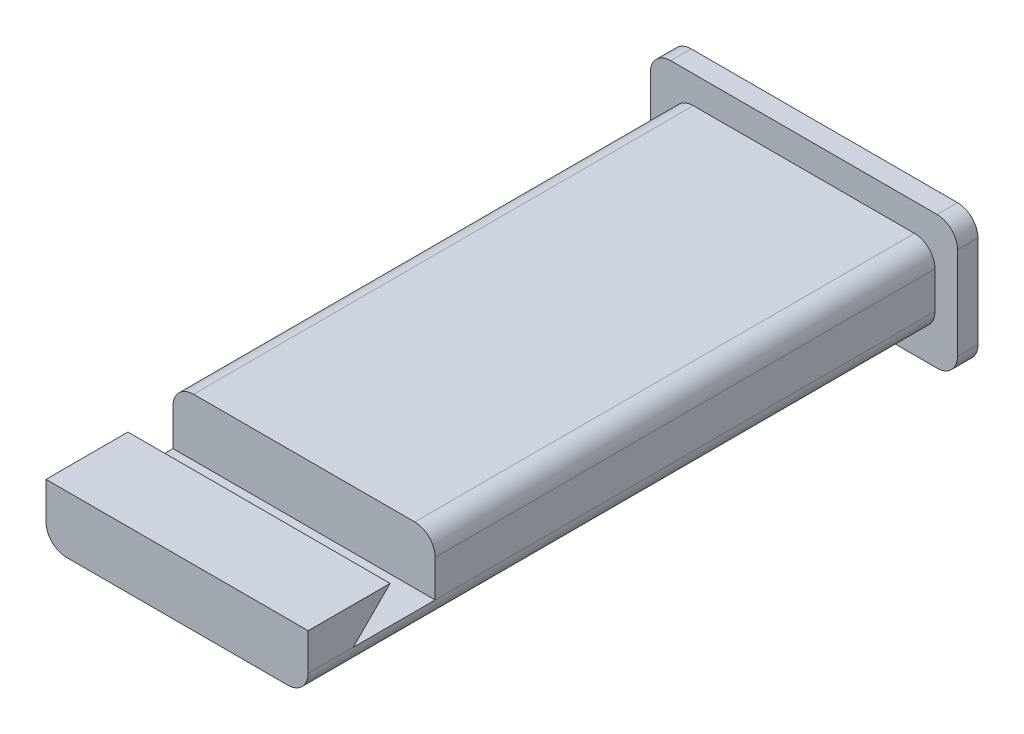
from build123d import *

# Parameters (mm, degrees)
SKETCH1_W           = 25.6
SKETCH1_H           = 7.6
BOSS_EXTRUDE1_DEPTH = 61.2
FILLET1_R           = 2
SKETCH2_W           = 30
SKETCH2_H           = 13
BOSS_EXTRUDE2_DEPTH = 2
FILLET2_R           = 2
CUT_EXTRUDE1_DEPTH  = 25.6


with BuildPart() as part:
    # Sketch1 → Boss-Extrude1 (new body)
    with BuildSketch(Plane.XY):
        Rectangle(SKETCH1_W, SKETCH1_H)
    extrude(amount=BOSS_EXTRUDE1_DEPTH)

    # Fillet1
    fillet1_edges = [part.edges().sort_by_distance(p)[0] for p in [
        (12.8, -3.8, 30.6),
        (-12.8, -3.8, 30.6),
        (-12.8, 3.8, 30.6),
        (12.8, 3.8, 30.6),
    ]]
    fillet(fillet1_edges, radius=FILLET1_R)

    # Sketch2 → Boss-Extrude2 (add)
    with BuildSketch(Plane(origin=(0, 0, 0), x_dir=(-1, 0, 0), z_dir=(0, 0, -1))):
        Rectangle(SKETCH2_W, SKETCH2_H)
    extrude(amount=BOSS_EXTRUDE2_DEPTH)

    # Fillet2
    fillet2_edges = [part.edges().sort_by_distance(p)[0] for p in [
        (-15, -6.5, -1),
        (-15, 6.5, -1),
        (15, 6.5, -1),
        (15, -6.5, -1),
    ]]
    fillet(fillet2_edges, radius=FILLET2_R)

    # Sketch3 → Cut-Extrude1 (cut)
    with BuildSketch(Plane.ZY.offset(12.8)):
        Polygon((48.8, -1.8), (56.8, -1.8), (53.2, 1.8), (61.2, 1.8), (61.2, 3.8), (48.8, 3.8), align=None)
    extrude(amount=-CUT_EXTRUDE1_DEPTH, mode=Mode.SUBTRACT)


solid = part.part
